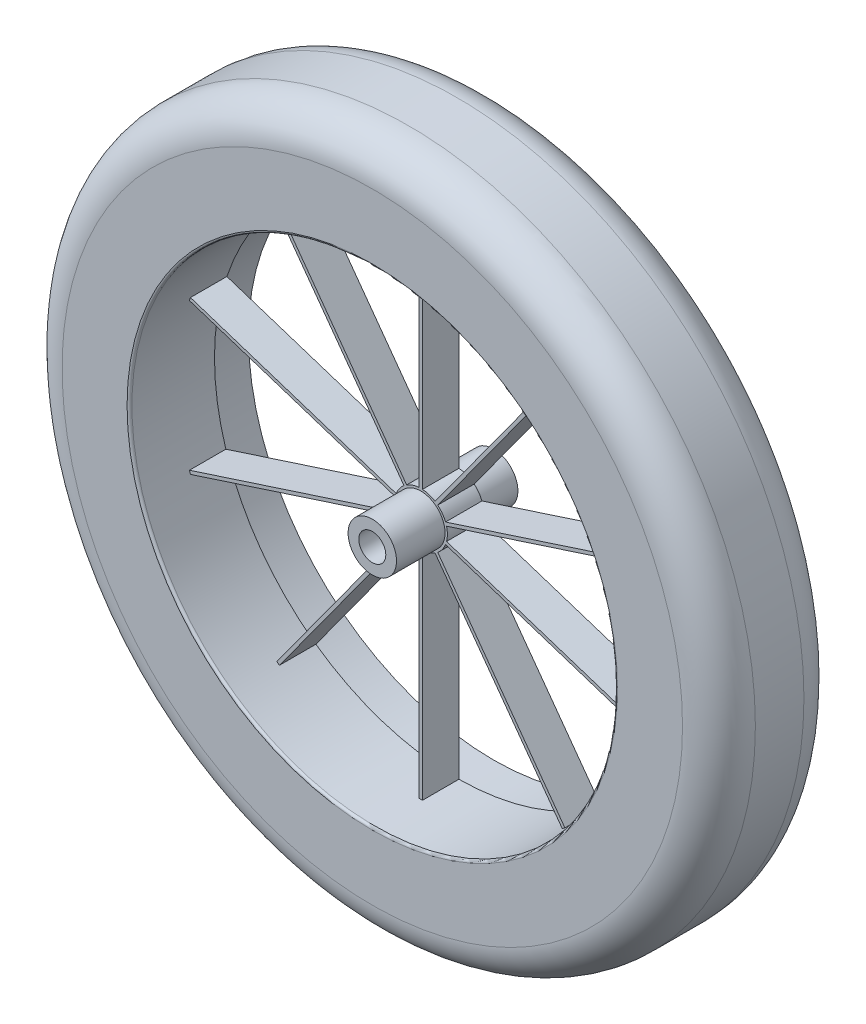
from build123d import *

# Parameters (mm, degrees)
CROQUIS1_R                   = 275
SALIENTE_EXTRUIR1_DEPTH      = 70
CROQUIS2_R                   = 200
CORTAR_EXTRUIR1_DEPTH        = 40
CROQUIS5_R                   = 10
CORTAR_EXTRUIR2_DEPTH        = 10
REDONDEO1_R                  = 2
CORTAR_EXTRUIR_L_MINA2_DEPTH = 396.15819617
MATRIZC1_COUNT               = 24
CORTAR_EXTRUIR3_DEPTH        = 150
SALIENTE_EXTRUIR2_DEPTH      = 50
SALIENTE_EXTRUIR2_DEPTH_BACK = 50
CROQUIS12_R                  = 19.934957438
CROQUIS14_R                  = 285.546784005
CROQUIS14_R_2                = 202
SALIENTE_EXTRUIR3_DEPTH      = 100
REDONDEO2_R                  = 30
REDONDEO3_R                  = 30
SCALE1_SCALE                 = 0.5
SCALE2_SCALE                 = 0.1
SCALE3_SCALE                 = 0.2
SCALE4_SCALE                 = 0.3
SCALE5_SCALE                 = 20
SCALE6_SCALE                 = 1.5
SKETCH1_R                    = 1
CUT_EXTRUDE1_DEPTH           = 5


with BuildPart() as part:
    # Croquis1 → Saliente-Extruir1 (new body)
    with BuildSketch(Plane.XY):
        Circle(CROQUIS1_R)
    extrude(amount=SALIENTE_EXTRUIR1_DEPTH)

    # Croquis2 → Cortar-Extruir1 (cut)
    with BuildSketch(Plane.XY.offset(70)):
        Circle(CROQUIS2_R)
    extrude(amount=-CORTAR_EXTRUIR1_DEPTH, mode=Mode.SUBTRACT)

    # Croquis5 → Cortar-Extruir2 (cut)
    with BuildSketch(Plane.XY.offset(30)):
        Circle(CROQUIS5_R)
    extrude(amount=-CORTAR_EXTRUIR2_DEPTH, mode=Mode.SUBTRACT)

    # Redondeo1
    redondeo1_edges = [part.edges().sort_by_distance(p)[0] for p in [
        (-200, 0, 70),
    ]]
    fillet(redondeo1_edges, radius=REDONDEO1_R)

    # Croquis6 → Cortar-Extruir-Lámina2 (cut, through all)
    with BuildSketch(Plane.XY.offset(70)):
        Polygon((-99.341458201, 256.429863086), (-89.226691548, 230.320640663), (-89.319938771, 230.284516496), (-99.434705424, 256.39373892), align=None)
    cortar_extruir_l_mina2 = extrude(amount=-CORTAR_EXTRUIR_L_MINA2_DEPTH, mode=Mode.SUBTRACT)

    # MatrizC1: Cortar-Extruir-Lámina2 ×24 about axis
    matrizc1_axis = Axis((0, 0, 0), (0, 0, 1))
    for i in range(1, MATRIZC1_COUNT):
        add(cortar_extruir_l_mina2.rotate(matrizc1_axis, i * 360 / MATRIZC1_COUNT), mode=Mode.SUBTRACT)

    # Croquis11 → Cortar-Extruir3 (cut)
    with BuildSketch(Plane.XY.offset(30)):
        with BuildLine():
            Line((-13.902980207, 16.854693372), (-118.639144382, 161.011656163))
            ThreePointArc((-118.639144382, 161.011656163), (-161.803398875, 117.557050458), (-189.792696605, 63.077193306))
            Line((-189.792696605, 63.077193306), (-20.326023118, 8.014133235))
            ThreePointArc((-20.326023118, 8.014133235), (-17.676115044, 12.842449309), (-13.902980207, 16.854693372))
        make_face()
        with BuildLine():
            Line((-1.340807064, 21.807700102), (-1.340807064, 199.995505541))
            ThreePointArc((-1.340807064, 199.995505541), (-61.803398875, 190.211303259), (-116.469672981, 162.587869399))
            Line((-116.469672981, 162.587869399), (-11.733508805, 18.430906609))
            ThreePointArc((-11.733508805, 18.430906609), (-6.751675158, 20.779519481), (-1.340807064, 21.807700102))
        make_face()
        with BuildLine():
            Line((11.733508805, 18.430906609), (116.469672981, 162.587869399))
            ThreePointArc((116.469672981, 162.587869399), (61.803398875, 190.211303259), (1.340807064, 199.995505541))
            Line((1.340807064, 199.995505541), (1.340807064, 21.807700102))
            ThreePointArc((1.340807064, 21.807700102), (6.751675158, 20.779519481), (11.733508805, 18.430906609))
        make_face()
        with BuildLine():
            Line((20.326023118, 8.014133235), (189.792696605, 63.077193306))
            ThreePointArc((189.792696605, 63.077193306), (161.803398875, 117.557050458), (118.639144382, 161.011656163))
            Line((118.639144382, 161.011656163), (13.902980207, 16.854693372))
            ThreePointArc((13.902980207, 16.854693372), (17.676115044, 12.842449309), (20.326023118, 8.014133235))
        make_face()
        with BuildLine():
            ThreePointArc((200, 0), (197.641433142, 30.624563763), (190.621360943, 60.526826715))
            Line((190.621360943, 60.526826715), (21.154687456, 5.463766645))
            ThreePointArc((21.154687456, 5.463766645), (21.674636908, 2.75384499), (21.848879772, 0))
            ThreePointArc((21.848879772, 0), (21.674636908, -2.75384499), (21.154687456, -5.463766645))
            Line((21.154687456, -5.463766644), (190.621360943, -60.526826715))
            ThreePointArc((190.621360943, -60.526826715), (197.641433142, -30.624563763), (200, 0))
        make_face()
        with BuildLine():
            ThreePointArc((118.639144382, -161.011656163), (161.803398875, -117.557050458), (189.792696605, -63.077193306))
            Line((189.792696605, -63.077193306), (20.326023118, -8.014133235))
            ThreePointArc((20.326023118, -8.014133235), (17.676115044, -12.842449309), (13.902980207, -16.854693372))
            Line((13.902980207, -16.854693372), (118.639144382, -161.011656163))
        make_face()
        with BuildLine():
            Line((-21.154687456, 5.463766645), (-190.621360943, 60.526826715))
            ThreePointArc((-190.621360943, 60.526826715), (-200, 0), (-190.621360943, -60.526826715))
            Line((-190.621360943, -60.526826715), (-21.154687456, -5.463766644))
            ThreePointArc((-21.154687456, -5.463766644), (-21.848879772, 0), (-21.154687456, 5.463766645))
        make_face()
        with BuildLine():
            ThreePointArc((-189.792696605, -63.077193306), (-161.803398875, -117.557050458), (-118.639144382, -161.011656163))
            Line((-118.639144382, -161.011656163), (-13.902980207, -16.854693372))
            ThreePointArc((-13.902980207, -16.854693372), (-17.676115044, -12.842449309), (-20.326023118, -8.014133235))
            Line((-20.326023118, -8.014133235), (-189.792696605, -63.077193306))
        make_face()
        with BuildLine():
            ThreePointArc((-116.469672981, -162.587869399), (-61.803398875, -190.211303259), (-1.340807064, -199.995505541))
            Line((-1.340807064, -199.995505541), (-1.340807064, -21.807700102))
            ThreePointArc((-1.340807064, -21.807700102), (-6.751675158, -20.779519481), (-11.733508805, -18.430906609))
            Line((-11.733508805, -18.430906609), (-116.469672981, -162.587869399))
        make_face()
        with BuildLine():
            ThreePointArc((1.340807064, -199.995505541), (61.803398875, -190.211303259), (116.469672981, -162.587869399))
            Line((116.469672981, -162.587869399), (11.733508805, -18.430906609))
            ThreePointArc((11.733508805, -18.430906609), (6.751675158, -20.779519481), (1.340807064, -21.807700102))
            Line((1.340807064, -21.807700102), (1.340807064, -199.995505541))
        make_face()
    extrude(amount=-CORTAR_EXTRUIR3_DEPTH, mode=Mode.SUBTRACT)

    # Croquis12 → Saliente-Extruir2 (add, two sides: drawn at the far end of the back side and taken through both)
    with BuildSketch(Plane.XY.offset(20).offset(-SALIENTE_EXTRUIR2_DEPTH_BACK)):
        Circle(CROQUIS12_R)
    extrude(amount=SALIENTE_EXTRUIR2_DEPTH + SALIENTE_EXTRUIR2_DEPTH_BACK)

    # Croquis14 → Saliente-Extruir3 (add)
    with BuildSketch(Plane.XY.offset(70)):
        Circle(CROQUIS14_R)
        Circle(CROQUIS14_R_2, mode=Mode.SUBTRACT)
    extrude(amount=-SALIENTE_EXTRUIR3_DEPTH)

    # Redondeo2
    redondeo2_edges = [part.edges().sort_by_distance(p)[0] for p in [
        (-285.546784005, 0, 70),
    ]]
    fillet(redondeo2_edges, radius=REDONDEO2_R)

    # Redondeo3
    redondeo3_edges = [part.edges().sort_by_distance(p)[0] for p in [
        (-285.546784005, 0, -30),
    ]]
    fillet(redondeo3_edges, radius=REDONDEO3_R)


with BuildPart() as part_1:
    # Scale1: scaled about (0, 0, 20.146701312)
    add(part.part.scale(SCALE1_SCALE).moved(Location((0, 0, 10.073350656))))


with BuildPart() as part_2:
    # Scale2: scaled about (0, 0, 20.146701312)
    add(part_1.part.scale(SCALE2_SCALE).moved(Location((0, 0, 18.132031181))))


with BuildPart() as part_3:
    # Scale3: scaled about (0, 0, 20.146701312)
    add(part_2.part.scale(SCALE3_SCALE).moved(Location((0, 0, 16.11736105))))


with BuildPart() as part_4:
    # Scale4: scaled about (0, 0, 20.146701312)
    add(part_3.part.scale(SCALE4_SCALE).moved(Location((0, 0, 14.102690918))))


with BuildPart() as part_5:
    # Scale5: scaled about (0, 0, 20.146701312)
    add(part_4.part.scale(SCALE5_SCALE).moved(Location((0, 0, -382.787324928))))


with BuildPart() as part_6:
    # Scale6: scaled about (0, 0, 20.146701312)
    add(part_5.part.scale(SCALE6_SCALE).moved(Location((0, 0, -10.073350656))))

    # Sketch1 → Cut-Extrude1 (cut)
    with BuildSketch(Plane.XY.offset(24.633498194)):
        Circle(SKETCH1_R)
    extrude(amount=-CUT_EXTRUDE1_DEPTH, mode=Mode.SUBTRACT)


solid = part_6.part
